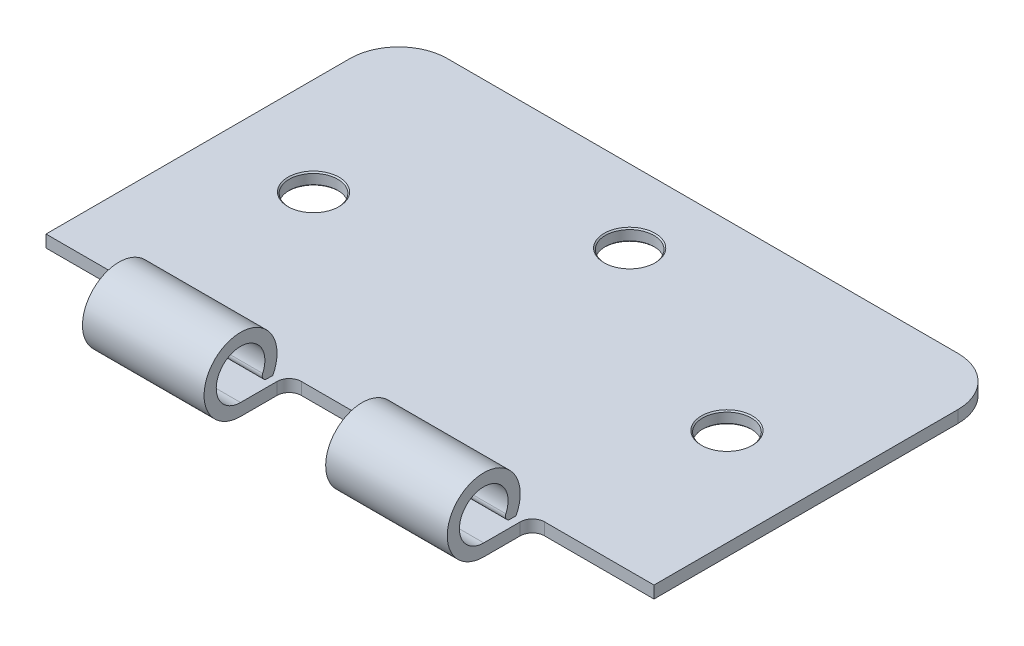
from build123d import *

# Parameters (mm, degrees)
SKETCH1_R           = 10
BOSS_EXTRUDE1_DEPTH = 5
BOSS_EXTRUDE2_DEPTH = 125
SKETCH3_W           = 50
SKETCH3_H           = 35
CUT_EXTRUDE1_DEPTH  = 30
FILLET1_R           = 5
CHAMFER1_SIZE       = 0.5


with BuildPart() as part:
    # Sketch1 → Boss-Extrude1 (new body)
    with BuildSketch(Plane(origin=(0, 0, 0), x_dir=(1, 0, 0), z_dir=(0, 1, 0))):
        with BuildLine():
            Line((-105, 150), (105, 150))
            ThreePointArc((105, 150), (119.142135624, 144.142135624), (125, 130))
            Line((125, 130), (125, 0))
            Line((125, 0), (-125, 0))
            Line((-125, 0), (-125, 130))
            ThreePointArc((-125, 130), (-119.142135624, 144.142135624), (-105, 150))
        make_face()
        with Locations(Location((-85, 75, 0), (0, 0, 270))):
            Circle(SKETCH1_R, mode=Mode.SUBTRACT)
        with Locations(Location((85, 75, 0), (0, 0, 270))):
            Circle(SKETCH1_R, mode=Mode.SUBTRACT)
        with Locations(Location((0, 120, 0), (0, 0, 270))):
            Circle(SKETCH1_R, mode=Mode.SUBTRACT)
    extrude(amount=BOSS_EXTRUDE1_DEPTH)

    # Sketch2 → Boss-Extrude2 (add, symmetric)
    with BuildSketch(Plane(origin=(0, 0, 0), x_dir=(0, 0, -1), z_dir=(1, 0, 0))):
        with BuildLine():
            Line((0, 0), (-15, 0))
            ThreePointArc((-15, 0), (-22.745966692, 27.845232579), (-1.733500839, 8))
            Line((-1.733500839, 8), (-4.091287885, 8))
            ThreePointArc((-4.091287885, 8), (-5.774538708, 8.91987655), (-5.909406571, 10.833333333))
            ThreePointArc((-5.909406571, 10.833333333), (-20.400617249, 23.416254115), (-15, 5))
            Line((-15, 5), (0, 5))
            Line((0, 5), (0, 0))
        make_face()
    extrude(amount=BOSS_EXTRUDE2_DEPTH, both=True)

    # Sketch3 → Cut-Extrude1 (cut, symmetric)
    with BuildSketch(Plane(origin=(0, 0, 0), x_dir=(1, 0, 0), z_dir=(0, 1, 0))):
        with Locations((-100, -12.5)):
            Rectangle(SKETCH3_W, SKETCH3_H)
        with Locations((0, -12.5)):
            Rectangle(SKETCH3_W, SKETCH3_H)
        with Locations((100, -12.5)):
            Rectangle(SKETCH3_W, SKETCH3_H)
    extrude(amount=CUT_EXTRUDE1_DEPTH, both=True, mode=Mode.SUBTRACT)

    # Fillet1
    fillet1_edges = [part.edges().sort_by_distance(p)[0] for p in [
        (75, 2.5, -5),
        (-75, 2.5, -5),
        (25, 2.5, -5),
        (-25, 2.5, -5),
    ]]
    fillet(fillet1_edges, radius=FILLET1_R)

    # Chamfer1
    chamfer1_edges = [part.edges().sort_by_distance(p)[0] for p in [
        (-85, 0, -85),
        (-85, 5, -85),
        (85, 0, -85),
        (85, 5, -85),
        (0, 0, -130),
        (0, 5, -130),
    ]]
    chamfer(chamfer1_edges, length=CHAMFER1_SIZE)


solid = part.part
